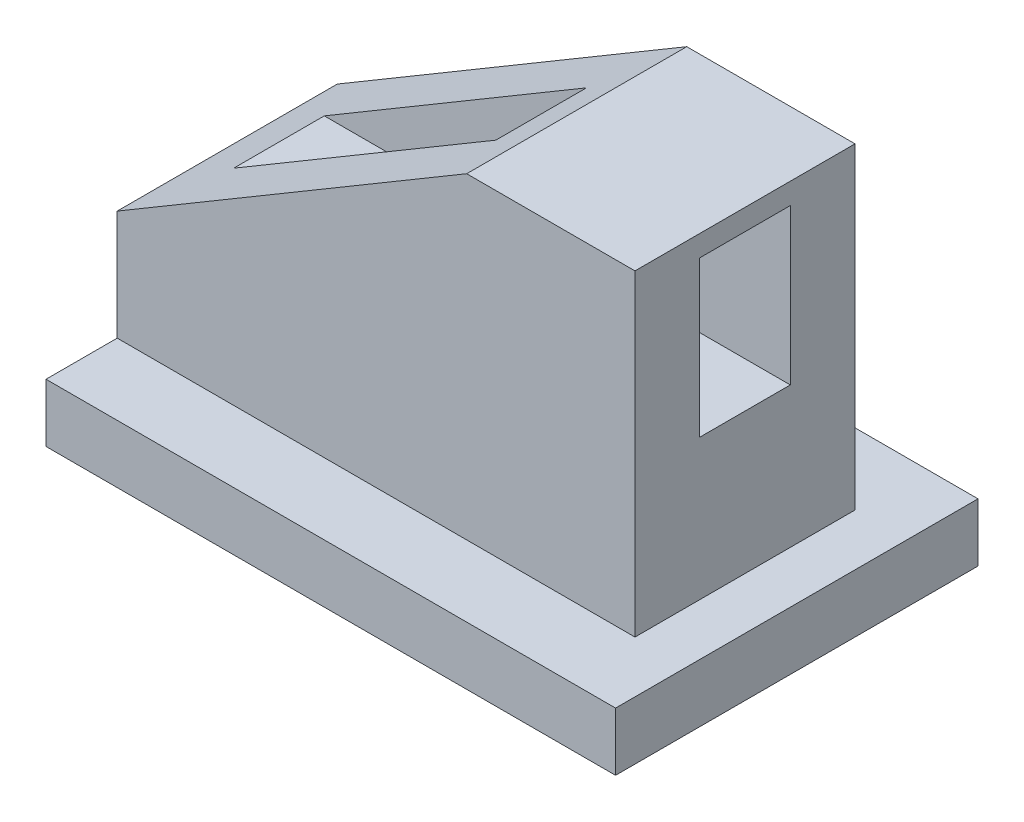
from build123d import *

# Parameters (mm, degrees)
SKETCH1_W           = 88
SKETCH1_H           = 56
BOSS_EXTRUDE1_DEPTH = 9
BOSS_EXTRUDE2_DEPTH = 34
SKETCH3_W           = 14
SKETCH3_H           = 24
CUT_EXTRUDE1_DEPTH  = 103.703456612


with BuildPart() as part:
    # Sketch1 → Boss-Extrude1 (new body)
    with BuildSketch(Plane(origin=(0, 0, 0), x_dir=(1, 0, 0), z_dir=(0, 1, 0))):
        Rectangle(SKETCH1_W, SKETCH1_H)
    extrude(amount=BOSS_EXTRUDE1_DEPTH)

    # Sketch2 → Boss-Extrude2 (add)
    with BuildSketch(Plane.XY.offset(17)):
        Polygon((-44, 9), (36, 9), (36, 58), (10, 58), (-44, 26), align=None)
    extrude(amount=-BOSS_EXTRUDE2_DEPTH)

    # Sketch3 → Cut-Extrude1 (cut, through all)
    with BuildSketch(Plane(origin=(36, 0, 0), x_dir=(0, 0, -1), z_dir=(1, 0, 0))):
        with Locations((0, 42.74)):
            Rectangle(SKETCH3_W, SKETCH3_H)
    extrude(amount=-CUT_EXTRUDE1_DEPTH, mode=Mode.SUBTRACT)


solid = part.part
